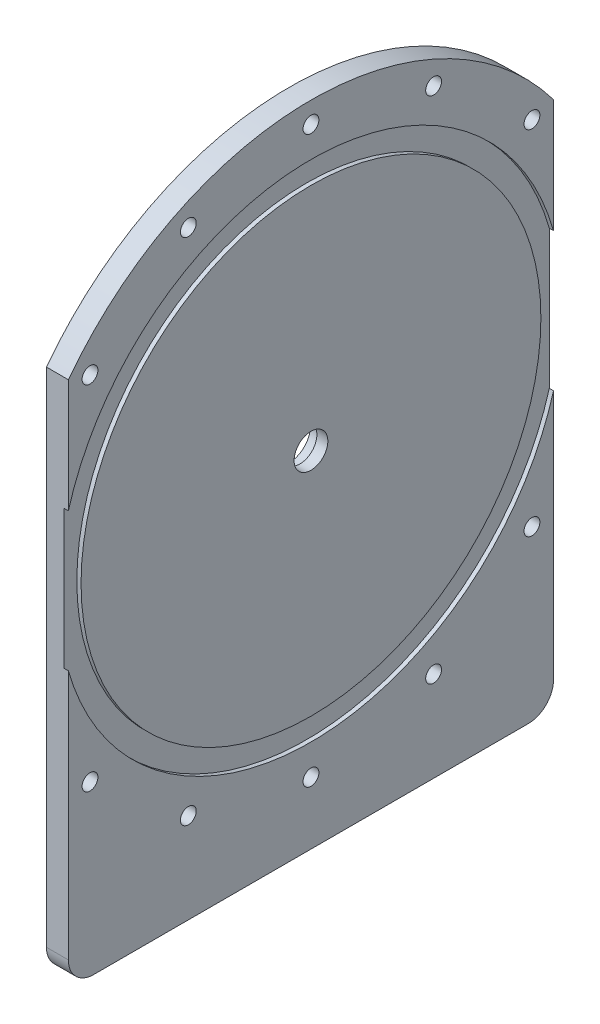
from build123d import *

# Parameters (mm, degrees)
SKETCH1_R           = 5.08
BOSS_EXTRUDE1_DEPTH = 6.604
SKETCH2_R           = 6.477
CUT_EXTRUDE1_DEPTH  = 3.302
SKETCH3_R           = 75.946
SKETCH3_R_2         = 69.215
CUT_EXTRUDE2_DEPTH  = 1.27
SKETCH4_R           = 2.38125
CUT_EXTRUDE3_DEPTH  = 139.530727768
SKETCH5_R           = 3.77825
CUT_EXTRUDE4_DEPTH  = 1.27
SKETCH6_W           = 37.512644612
SKETCH6_H           = 125.02997604
SKETCH6_W_2         = 29.936636925
CUT_EXTRUDE6_DEPTH  = 139.530727768


with BuildPart() as part:
    # Sketch1 → Boss-Extrude1 (new body)
    with BuildSketch(Plane(origin=(0, 0, 0), x_dir=(0, 0, -1), z_dir=(1, 0, 0))):
        with BuildLine():
            Line((-65.405, -103.855072673), (65.405, -103.855072673))
            ThreePointArc((65.405, -103.855072673), (70.793153673, -101.623226346), (73.025, -96.235072673))
            Line((73.025, -96.235072673), (73.025, -69.997049759))
            ThreePointArc((73.025, -69.997049759), (74.696702219, -57.072253546), (79.601785714, -44.998103417))
            ThreePointArc((79.601785714, -44.998103417), (0, 91.44), (-79.601785714, -44.998103417))
            ThreePointArc((-79.601785714, -44.998103417), (-74.696702219, -57.072253546), (-73.025, -69.997049759))
            Line((-73.025, -69.997049759), (-73.025, -96.235072673))
            ThreePointArc((-73.025, -96.235072673), (-70.793153673, -101.623226346), (-65.405, -103.855072673))
        make_face()
        with Locations(Location((0, 0, 0), (0, 0, 180))):
            Circle(SKETCH1_R, mode=Mode.SUBTRACT)
    extrude(amount=BOSS_EXTRUDE1_DEPTH)

    # Sketch2 → Cut-Extrude1 (cut)
    with BuildSketch(Plane(origin=(0, 0, 0), x_dir=(0, 0, -1), z_dir=(1, 0, 0))):
        with Locations(Location((0, 0, 0), (0, 0, 180))):
            Circle(SKETCH2_R)
    extrude(amount=CUT_EXTRUDE1_DEPTH, mode=Mode.SUBTRACT)

    # Sketch3 → Cut-Extrude2 (cut)
    with BuildSketch(Plane(origin=(6.604, 0, 0), x_dir=(0, 0, -1), z_dir=(1, 0, 0))):
        Circle(SKETCH3_R)
        Circle(SKETCH3_R_2, mode=Mode.SUBTRACT)
    extrude(amount=-CUT_EXTRUDE2_DEPTH, mode=Mode.SUBTRACT)

    # Sketch4 → Cut-Extrude3 (cut, through all)
    with BuildSketch(Plane.ZY):
        with Locations((-82.956616048, 18.93430627)):
            Circle(SKETCH4_R)
        with Locations((0, 85.09)):
            Circle(SKETCH4_R)
        with Locations((-66.526040843, 53.05274724)):
            Circle(SKETCH4_R)
        with Locations((36.919167362, 76.66344097)):
            Circle(SKETCH4_R)
        with Locations((66.526040843, 53.05274724)):
            Circle(SKETCH4_R)
        with Locations((82.956616048, 18.93430627)):
            Circle(SKETCH4_R)
        with Locations((82.956616048, -18.93430627)):
            Circle(SKETCH4_R)
        with Locations((66.526040843, -53.05274724)):
            Circle(SKETCH4_R)
        with Locations((36.919167362, -76.66344097)):
            Circle(SKETCH4_R)
        with Locations((0, -85.09)):
            Circle(SKETCH4_R)
        with Locations((-36.919167361, -76.66344097)):
            Circle(SKETCH4_R)
        with Locations((-66.526040843, -53.05274724)):
            Circle(SKETCH4_R)
        with Locations((-82.956616048, -18.93430627)):
            Circle(SKETCH4_R)
        with Locations((-36.919167362, 76.66344097)):
            Circle(SKETCH4_R)
    extrude(amount=-CUT_EXTRUDE3_DEPTH, mode=Mode.SUBTRACT)

    # Sketch5 → Cut-Extrude4 (cut)
    with BuildSketch(Plane.ZY):
        with Locations((0, 85.09)):
            Circle(SKETCH5_R)
        with Locations((-82.956616048, 18.93430627)):
            Circle(SKETCH5_R)
        with Locations((-66.526040843, 53.05274724)):
            Circle(SKETCH5_R)
        with Locations((36.919167362, 76.66344097)):
            Circle(SKETCH5_R)
        with Locations((-36.919167362, 76.66344097)):
            Circle(SKETCH5_R)
        with Locations((66.526040843, 53.05274724)):
            Circle(SKETCH5_R)
        with Locations((82.956616048, 18.93430627)):
            Circle(SKETCH5_R)
        with Locations((82.956616048, -18.93430627)):
            Circle(SKETCH5_R)
        with Locations((66.526040843, -53.05274724)):
            Circle(SKETCH5_R)
        with Locations((36.919167362, -76.66344097)):
            Circle(SKETCH5_R)
        with Locations((0, -85.09)):
            Circle(SKETCH5_R)
        with Locations((-36.919167362, -76.66344097)):
            Circle(SKETCH5_R)
        with Locations((-66.526040843, -53.05274724)):
            Circle(SKETCH5_R)
        with Locations((-82.956616048, -18.93430627)):
            Circle(SKETCH5_R)
    extrude(amount=-CUT_EXTRUDE4_DEPTH, mode=Mode.SUBTRACT)

    # Sketch6 → Cut-Extrude6 (cut, through all)
    with BuildSketch(Plane(origin=(6.604, 0, 0), x_dir=(0, 0, -1), z_dir=(1, 0, 0))):
        with Locations((-91.781322306, -7.482061739)):
            Rectangle(SKETCH6_W, SKETCH6_H)
        with Locations((87.993318463, -7.482061739)):
            Rectangle(SKETCH6_W_2, SKETCH6_H)
    extrude(amount=-CUT_EXTRUDE6_DEPTH, mode=Mode.SUBTRACT)


solid = part.part
